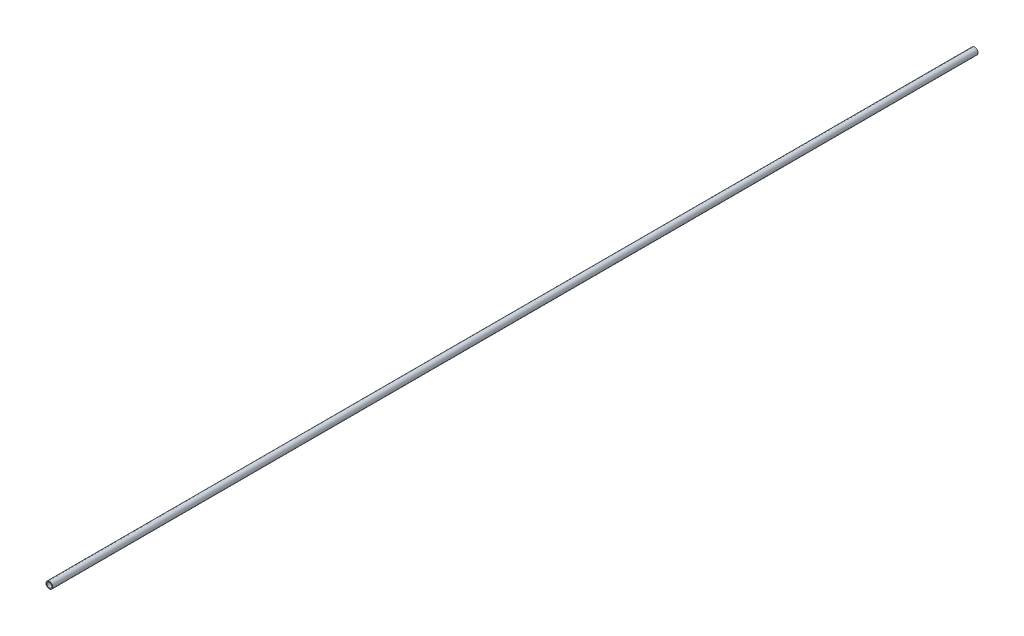
from build123d import *

# Parameters (mm, degrees)
SKETCH1_R           = 4.7625
SKETCH1_R_2         = 3.5179
BOSS_EXTRUDE1_DEPTH = 1326.3731918


with BuildPart() as part:
    # Sketch1 → Boss-Extrude1 (new body)
    with BuildSketch(Plane.XY):
        Circle(SKETCH1_R)
        Circle(SKETCH1_R_2, mode=Mode.SUBTRACT)
    extrude(amount=BOSS_EXTRUDE1_DEPTH)


solid = part.part
